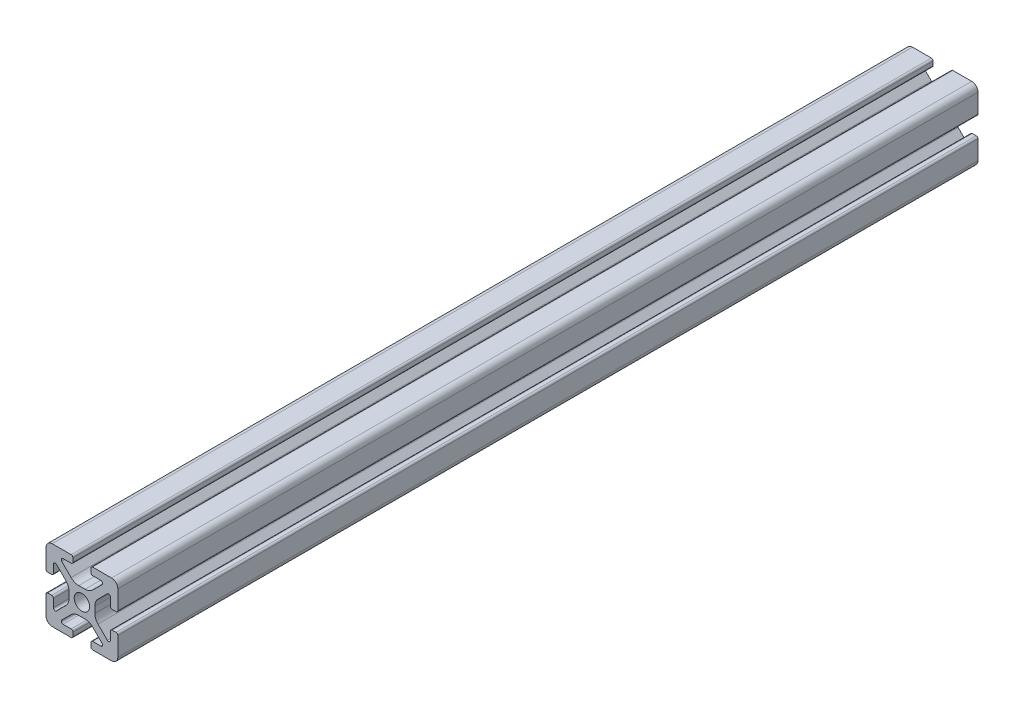
from build123d import *

# Parameters (mm, degrees)
BOSS_EXTRUDE1_DEPTH = 121
SKETCH5_W           = 27.787302718
SKETCH5_H           = 26.03929452
CUT_EXTRUDE1_DEPTH  = 2.4


with BuildPart() as part:
    # Sketch4 → Boss-Extrude1 (new, symmetric)
    with BuildSketch(Plane.XY):
        with BuildLine():
            Line((3, -10), (8.25, -10))
            ThreePointArc((8.25, -10), (9.487436867, -9.487436867), (10, -8.25))
            Line((10, -8.25), (10, -3))
            ThreePointArc((10, -3), (9.853553391, -2.646446609), (9.5, -2.5))
            Line((9.5, -2.5), (8.424621202, -2.5))
            ThreePointArc((8.424621202, -2.5), (8.071067812, -2.646446609), (7.924621202, -3))
            Line((7.924621202, -3), (7.924621202, -5.25))
            ThreePointArc((7.924621202, -5.25), (7.615962919, -5.711939766), (7.071067812, -5.603553391))
            Line((7.071067812, -5.603553391), (4.478679656, -3.011165235))
            ThreePointArc((4.478679656, -3.011165235), (3.828361402, -2.037895189), (3.6, -0.889844892))
            Line((3.6, -0.889844892), (3.6, 0))
            Line((3.6, 0), (2.15, 0))
            ThreePointArc((2.15, 0), (1.52027958, -1.52027958), (0, -2.15))
            Line((0, -2.15), (0, -3.6))
            Line((0, -3.6), (0.889844892, -3.6))
            ThreePointArc((0.889844892, -3.6), (2.037895189, -3.828361402), (3.011165235, -4.478679656))
            Line((3.011165235, -4.478679656), (5.603553391, -7.071067812))
            ThreePointArc((5.603553391, -7.071067812), (5.711939766, -7.615962919), (5.25, -7.924621202))
            Line((5.25, -7.924621202), (3, -7.924621202))
            ThreePointArc((3, -7.924621202), (2.646446609, -8.071067812), (2.5, -8.424621202))
            Line((2.5, -8.424621202), (2.5, -9.5))
            ThreePointArc((2.5, -9.5), (2.646446609, -9.853553391), (3, -10))
        make_face()
    extrude(amount=BOSS_EXTRUDE1_DEPTH, both=True)

    # Mirror1: part across plane


with BuildPart() as part_1:
    add(part.part)
    add(part.part.mirror(Plane(origin=(0, 0, 0), x_dir=(0, 0, 1), z_dir=(1, 0, 0))))

    # Mirror2: part across plane


with BuildPart() as part_2:
    add(part_1.part)
    add(part_1.part.mirror(Plane.ZX))

    # Sketch5 → Cut-Extrude1 (cut)
    with BuildSketch(Plane.XY.offset(121)):
        with Locations((-0.060276145, -0.663037592)):
            Rectangle(SKETCH5_W, SKETCH5_H)
    extrude(amount=-CUT_EXTRUDE1_DEPTH, mode=Mode.SUBTRACT)


solid = part_2.part
